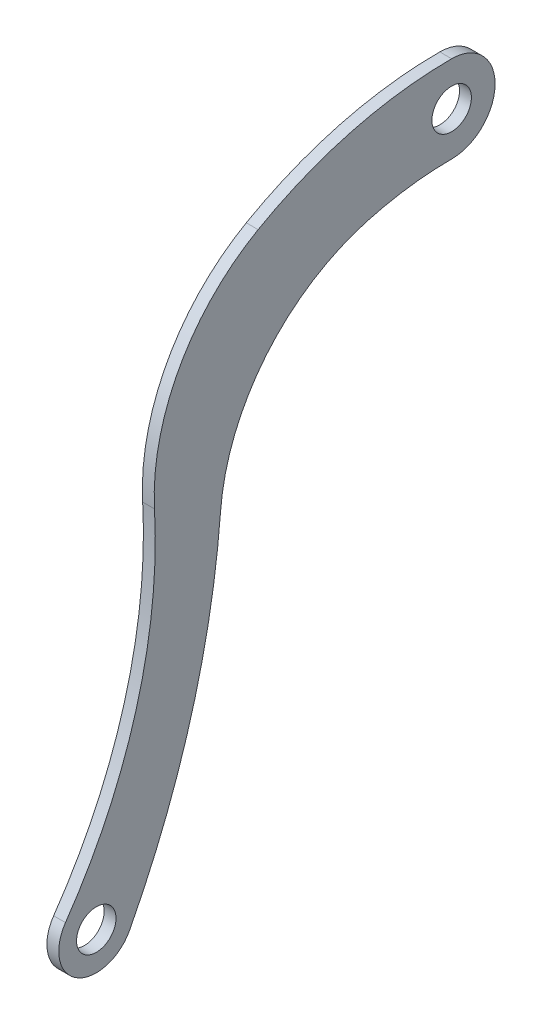
from build123d import *

# Parameters (mm, degrees)
BOSS_EXTRUDE1_DEPTH = 1.5
SKETCH2_R           = 5
CUT_EXTRUDE1_DEPTH  = 142.810613143


with BuildPart() as part:
    # Sketch1 → Boss-Extrude1 (new, symmetric)
    with BuildSketch(Plane(origin=(0, 0, 0), x_dir=(0, 0, -1), z_dir=(1, 0, 0))):
        with BuildLine():
            ThreePointArc((0, 79), (11, 90), (0, 101))
            ThreePointArc((0, 101), (-25.350874614, 97.701945149), (-49.014054674, 88.027343403))
            ThreePointArc((-49.014054674, 88.027343403), (-68.978437503, 67.692387852), (-75.252234106, 39.89442974))
            ThreePointArc((-75.252234106, 39.89442974), (-79.876334442, -1.725579257), (-97.797422275, -39.573195612))
            ThreePointArc((-97.797422275, -39.573195612), (-94.917356951, -53.128320897), (-81.574017035, -49.387802533))
            ThreePointArc((-81.574017035, -49.387802533), (-66.010073659, -10.395208993), (-58.530464131, 30.917187762))
            ThreePointArc((-58.530464131, 30.917187762), (-46.946256543, 59.483246729), (-21.037120215, 76.184451628))
            ThreePointArc((-21.037120215, 76.184451628), (-10.612348227, 78.292988751), (0, 79))
        make_face()
    extrude(amount=BOSS_EXTRUDE1_DEPTH, both=True)

    # Sketch2 → Cut-Extrude1 (cut, through all)
    with BuildSketch(Plane(origin=(1.5, 0, 0), x_dir=(0, 0, -1), z_dir=(1, 0, 0))):
        with Locations((0, 90)):
            Circle(SKETCH2_R)
        with Locations((-90, -45)):
            Circle(SKETCH2_R)
    extrude(amount=-CUT_EXTRUDE1_DEPTH, mode=Mode.SUBTRACT)


solid = part.part
